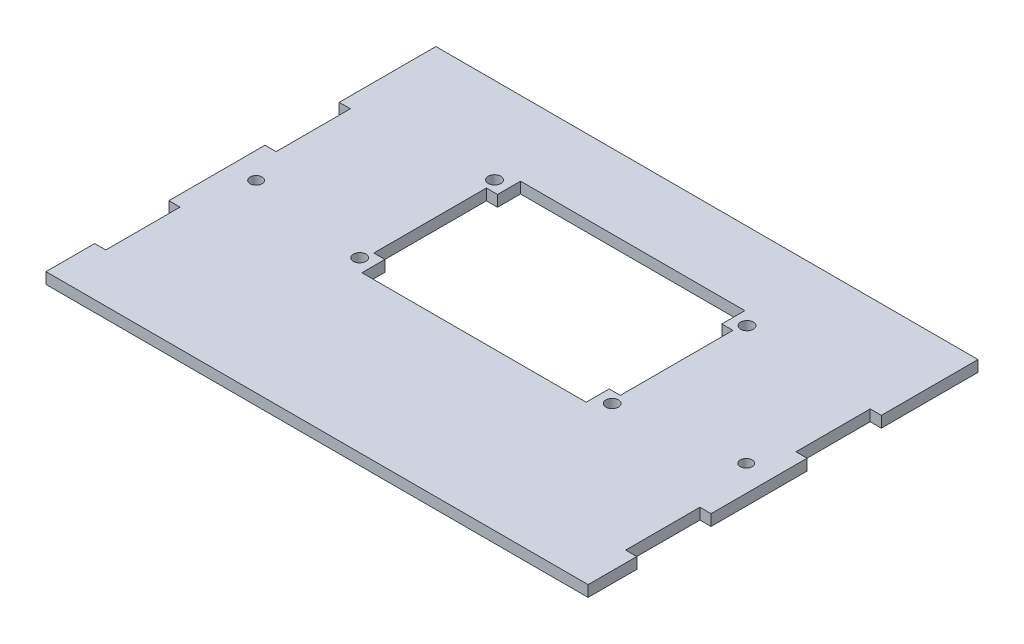
from build123d import *

# Parameters (mm, degrees)
SKETCH1_W           = 146
SKETCH1_H           = 105
BOSS_EXTRUDE1_DEPTH = 3
SKETCH2_W           = 3
SKETCH2_H           = 20
CUT_EXTRUDE1_DEPTH  = 10
SKETCH3_R           = 1.7
SKETCH3_W           = 60.4
SKETCH3_H           = 42.72
CUT_EXTRUDE2_DEPTH  = 3
SKETCH5_W           = 3
SKETCH5_H           = 30.32
CUT_EXTRUDE4_DEPTH  = 90.968049884
SKETCH6_R           = 1.6
CUT_EXTRUDE5_DEPTH  = 10


with BuildPart() as part:
    # Sketch1 → Boss-Extrude1 (new body)
    with BuildSketch(Plane(origin=(0, 0, 0), x_dir=(1, 0, 0), z_dir=(0, 1, 0))):
        Rectangle(SKETCH1_W, SKETCH1_H)
    extrude(amount=BOSS_EXTRUDE1_DEPTH)

    # Sketch2 → Cut-Extrude1 (cut)
    with BuildSketch(Plane(origin=(0, 3, 0), x_dir=(1, 0, 0), z_dir=(0, 1, 0))):
        with Locations((-71.5, 16.47)):
            Rectangle(SKETCH2_W, SKETCH2_H)
        with Locations((71.5, 16.47)):
            Rectangle(SKETCH2_W, SKETCH2_H)
        with Locations((-71.5, -29.4)):
            Rectangle(SKETCH2_W, SKETCH2_H)
        with Locations((71.5, -29.4)):
            Rectangle(SKETCH2_W, SKETCH2_H)
    extrude(amount=-CUT_EXTRUDE1_DEPTH, mode=Mode.SUBTRACT)

    # Sketch3 → Cut-Extrude2 (cut)
    with BuildSketch(Plane(origin=(0, 0, 0), x_dir=(-1, 0, 0), z_dir=(0, -1, 0))):
        with Locations(Location((-34, 29.3, 0), (0, 0, 90))):
            Circle(SKETCH3_R)
        with Locations(Location((-34, -7.02, 0), (0, 0, 90))):
            Circle(SKETCH3_R)
        with Locations(Location((34, 29.3, 0), (0, 0, 90))):
            Circle(SKETCH3_R)
        with Locations(Location((34, -7.02, 0), (0, 0, 90))):
            Circle(SKETCH3_R)
        with Locations((0, 11.14)):
            Rectangle(SKETCH3_W, SKETCH3_H)
    extrude(amount=-CUT_EXTRUDE2_DEPTH, mode=Mode.SUBTRACT)

    # Sketch5 → Cut-Extrude4 (cut, through all)
    with BuildSketch(Plane(origin=(0, 0, 0), x_dir=(-1, 0, 0), z_dir=(0, -1, 0))):
        with Locations((31.7, 11.14)):
            Rectangle(SKETCH5_W, SKETCH5_H)
        with Locations((-31.7, 11.14)):
            Rectangle(SKETCH5_W, SKETCH5_H)
    extrude(amount=-CUT_EXTRUDE4_DEPTH, mode=Mode.SUBTRACT)

    # Sketch6 → Cut-Extrude5 (cut)
    with BuildSketch(Plane.XZ):
        with Locations(Location((-66, 2.92, 0), (0, 0, 270))):
            Circle(SKETCH6_R)
        with Locations(Location((66, 2.92, 0), (0, 0, 270))):
            Circle(SKETCH6_R)
    extrude(amount=-CUT_EXTRUDE5_DEPTH, mode=Mode.SUBTRACT)


solid = part.part
